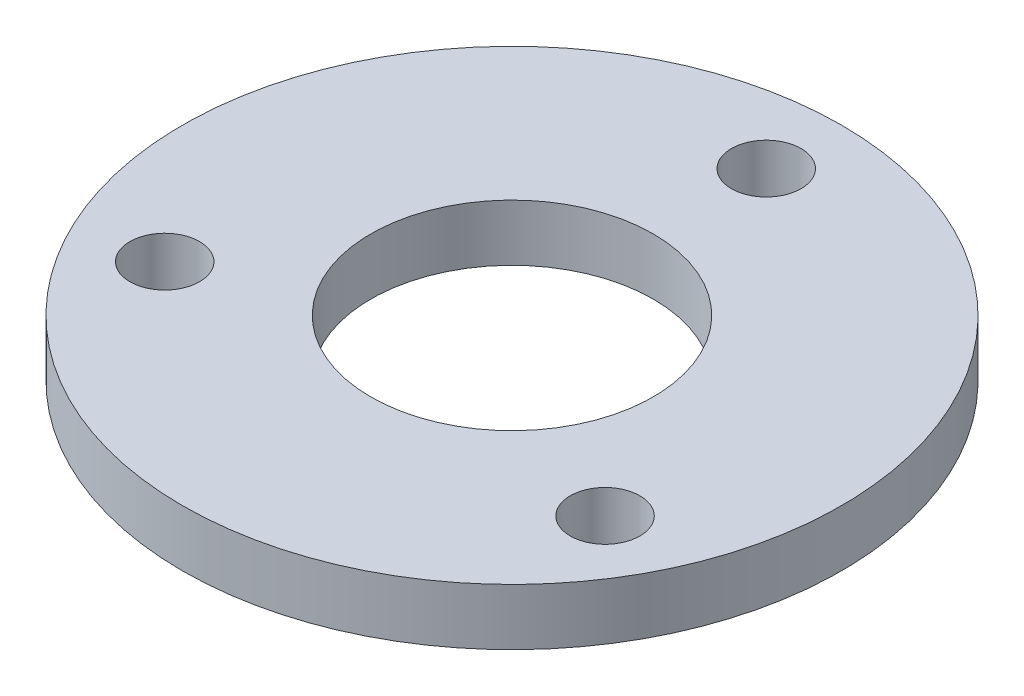
from build123d import *

# Parameters (mm, degrees)
SKETCH_1_R      = 17.5
SKETCH_1_R_2    = 1.85
SKETCH_1_R_3    = 7.5
EXTRUDE_1_DEPTH = 3


with BuildPart() as part:
    # 草图1 → 凸台-拉伸1 (new body)
    with BuildSketch(Plane(origin=(0, 0, 0), x_dir=(1, 0, 0), z_dir=(0, 1, 0))):
        with Locations(Location((0, 0, 0), (0, 0, 270))):
            Circle(SKETCH_1_R)
        with Locations(Location((0, 13.5, 0), (0, 0, 270))):
            Circle(SKETCH_1_R_2, mode=Mode.SUBTRACT)
        with Locations(Location((11.691342951, -6.75, 0), (0, 0, 270))):
            Circle(SKETCH_1_R_2, mode=Mode.SUBTRACT)
        with Locations(Location((-11.691342951, -6.75, 0), (0, 0, 270))):
            Circle(SKETCH_1_R_2, mode=Mode.SUBTRACT)
        with Locations(Location((0, 0, 0), (0, 0, 270))):
            Circle(SKETCH_1_R_3, mode=Mode.SUBTRACT)
    extrude(amount=EXTRUDE_1_DEPTH)


solid = part.part
